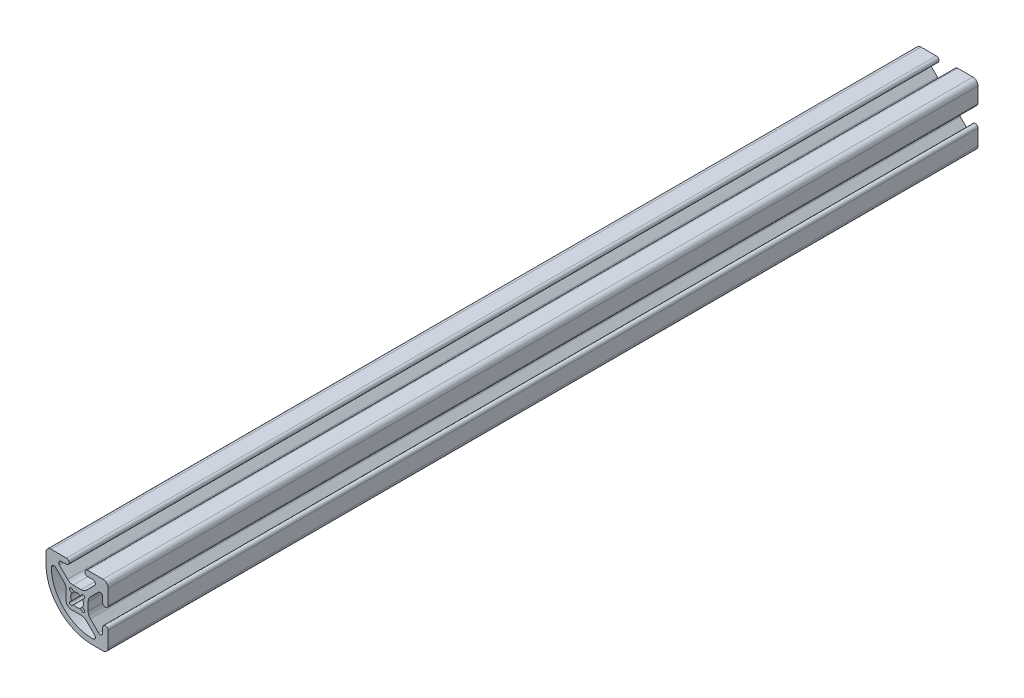
from build123d import *

# Parameters (mm, degrees)
EXTRUDE1_DEPTH = 355.6


with BuildPart() as part:
    # Sketch2 → Extrude1 (new body)
    with BuildSketch(Plane.XY):
        with BuildLine():
            Line((-4.3561, 12.7), (-10.5918, 12.7))
            ThreePointArc((-10.5918, 12.7), (-12.082522516, 12.082522516), (-12.7, 10.5918))
            Line((-12.7, 10.5918), (-12.7, 6.35))
            ThreePointArc((-12.7, 6.35), (-7.120384182, -7.120384182), (6.35, -12.7))
            Line((6.35, -12.7), (10.5918, -12.7))
            ThreePointArc((10.5918, -12.7), (12.082522516, -12.082522516), (12.7, -10.5918))
            Line((12.7, -10.5918), (12.7, -4.3561))
            ThreePointArc((12.7, -4.3561), (11.5951, -3.2512), (10.4902, -4.3561))
            Line((10.4902, -4.3561), (10.4902, -6.474899798))
            ThreePointArc((10.4902, -6.474899798), (9.863006367, -7.413561403), (8.75577951, -7.193320288))
            Line((8.75577951, -7.193320288), (5.447103113, -3.88464389))
            ThreePointArc((5.447103113, -3.88464389), (4.758849627, -2.854599758), (4.517167143, -1.63957986))
            Line((4.517167143, -1.63957986), (4.517167143, 1.63957986))
            ThreePointArc((4.517167143, 1.63957986), (4.758849627, 2.854599758), (5.447103113, 3.88464389))
            Line((5.447103113, 3.88464389), (8.75577951, 7.193320288))
            ThreePointArc((8.75577951, 7.193320288), (9.863006367, 7.413561403), (10.4902, 6.474899798))
            Line((10.4902, 6.474899798), (10.4902, 4.3561))
            ThreePointArc((10.4902, 4.3561), (11.5951, 3.2512), (12.7, 4.3561))
            Line((12.7, 4.3561), (12.7, 10.5918))
            ThreePointArc((12.7, 10.5918), (12.082522516, 12.082522516), (10.5918, 12.7))
            Line((10.5918, 12.7), (4.3561, 12.7))
            ThreePointArc((4.3561, 12.7), (3.2512, 11.5951), (4.3561, 10.4902))
            Line((4.3561, 10.4902), (6.474899798, 10.4902))
            ThreePointArc((6.474899798, 10.4902), (7.413561403, 9.863006367), (7.193320288, 8.75577951))
            Line((7.193320288, 8.75577951), (3.88464389, 5.447103113))
            ThreePointArc((3.88464389, 5.447103113), (2.854599758, 4.758849627), (1.63957986, 4.517167143))
            Line((1.63957986, 4.517167143), (-1.63957986, 4.517167143))
            ThreePointArc((-1.63957986, 4.517167143), (-2.854599758, 4.758849627), (-3.88464389, 5.447103113))
            Line((-3.88464389, 5.447103113), (-7.193320288, 8.75577951))
            ThreePointArc((-7.193320288, 8.75577951), (-7.413561403, 9.863006367), (-6.474899798, 10.4902))
            Line((-6.474899798, 10.4902), (-4.3561, 10.4902))
            ThreePointArc((-4.3561, 10.4902), (-3.2512, 11.5951), (-4.3561, 12.7))
        make_face()
        with BuildLine():
            Line((-1.340533428, -2.231856263), (-1.969151357, -2.860474191))
            ThreePointArc((-1.969151357, -2.860474191), (-2.918583239, -2.918583239), (-2.860474191, -1.969151357))
            Line((-2.860474191, -1.969151357), (-2.231856263, -1.340533428))
            ThreePointArc((-2.231856263, -1.340533428), (-2.6035, 0), (-2.231856263, 1.340533428))
            Line((-2.231856263, 1.340533428), (-2.860474191, 1.969151357))
            ThreePointArc((-2.860474191, 1.969151357), (-2.918583239, 2.918583239), (-1.969151357, 2.860474191))
            Line((-1.969151357, 2.860474191), (-1.340533428, 2.231856263))
            ThreePointArc((-1.340533428, 2.231856263), (0, 2.6035), (1.340533428, 2.231856263))
            Line((1.340533428, 2.231856263), (1.969151357, 2.860474191))
            ThreePointArc((1.969151357, 2.860474191), (2.918583239, 2.918583239), (2.860474191, 1.969151357))
            Line((2.860474191, 1.969151357), (2.231856263, 1.340533428))
            ThreePointArc((2.231856263, 1.340533428), (2.6035, 0), (2.231856263, -1.340533428))
            Line((2.231856263, -1.340533428), (2.860474191, -1.969151357))
            ThreePointArc((2.860474191, -1.969151357), (2.918583239, -2.918583239), (1.969151357, -2.860474191))
            Line((1.969151357, -2.860474191), (1.340533428, -2.231856263))
            ThreePointArc((1.340533428, -2.231856263), (0, -2.6035), (-1.340533428, -2.231856263))
        make_face(mode=Mode.SUBTRACT)
        with BuildLine():
            Line((3.884538548, -5.447103113), (7.192726697, -8.755291262))
            ThreePointArc((7.192726697, -8.755291262), (7.414487708, -9.858828287), (6.482287344, -10.489680404))
            ThreePointArc((6.482287344, -10.489680404), (-5.557819617, -5.557819617), (-10.489680404, 6.482287344))
            ThreePointArc((-10.489680404, 6.482287344), (-9.858828287, 7.414487708), (-8.755291262, 7.192726697))
            Line((-8.755291262, 7.192726697), (-5.447103113, 3.884538548))
            ThreePointArc((-5.447103113, 3.884538548), (-4.758849627, 2.854494415), (-4.517167143, 1.639474517))
            Line((-4.517167143, 1.639474517), (-4.517167143, -2.307367143))
            ThreePointArc((-4.517167143, -2.307367143), (-3.869931708, -3.869931708), (-2.307367143, -4.517167143))
            Line((-2.307367143, -4.517167143), (1.639474517, -4.517167143))
            ThreePointArc((1.639474517, -4.517167143), (2.854494415, -4.758849627), (3.884538548, -5.447103113))
        make_face(mode=Mode.SUBTRACT)
    extrude(amount=-EXTRUDE1_DEPTH)


solid = part.part
